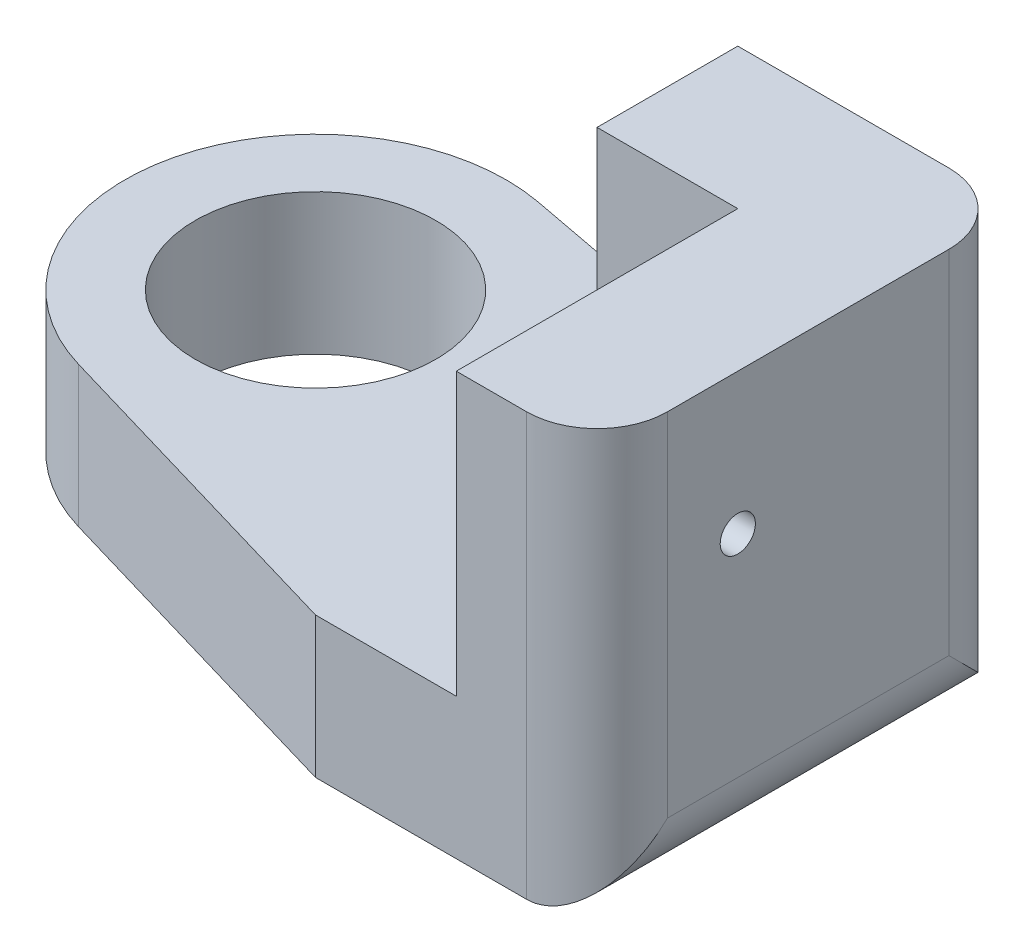
from build123d import *

# Parameters (mm, degrees)
SKETCH1_W           = 20
SKETCH1_H           = 30
BOSS_EXTRUDE1_DEPTH = 10
BOSS_EXTRUDE2_DEPTH = 10
SKETCH4_R           = 8.55
BOSS_EXTRUDE3_DEPTH = 10
FILLET1_R           = 5
BOSS_EXTRUDE4_DEPTH = 10
SKETCH6_R           = 1.25
CUT_EXTRUDE1_DEPTH  = 10


with BuildPart() as part:
    # Sketch1 → Boss-Extrude1 (new body)
    with BuildSketch(Plane(origin=(0, 0, 0), x_dir=(1, 0, 0), z_dir=(0, 1, 0))):
        with Locations((10, -15)):
            Rectangle(SKETCH1_W, SKETCH1_H)
    extrude(amount=BOSS_EXTRUDE1_DEPTH)

    # Sketch2 → Boss-Extrude2 (add)
    with BuildSketch(Plane(origin=(0, 10, 0), x_dir=(1, 0, 0), z_dir=(0, 1, 0))):
        Polygon((0, 0), (0, -10), (10, -10), (10, -30), (20, -30), (20, 0), align=None)
    extrude(amount=BOSS_EXTRUDE2_DEPTH)

    # Sketch4 → Boss-Extrude3 (add)
    with BuildSketch(Plane(origin=(0, 10, 0), x_dir=(1, 0, 0), z_dir=(0, 1, 0))):
        with BuildLine():
            Line((0, 0), (-17.51372228, 3.319944561))
            ThreePointArc((-17.51372228, 3.319944561), (-33.173842605, -6.829452566), (-23.846362973, -22.992612973))
            Line((-23.846362973, -22.992612973), (0, -30))
            Line((0, -30), (0, 0))
        make_face()
        with Locations(Location((-20, -10, 0), (0, 0, 270))):
            Circle(SKETCH4_R, mode=Mode.SUBTRACT)
    extrude(amount=-BOSS_EXTRUDE3_DEPTH)

    # Fillet1
    fillet1_edges = [part.edges().sort_by_distance(p)[0] for p in [
        (0, 10, 5),
        (20, 0, 15),
        (20, 10, 0),
        (20, 10, 30),
    ]]
    fillet(fillet1_edges, radius=FILLET1_R)

    # Sketch5 → Boss-Extrude4 (add)
    with BuildSketch(Plane(origin=(0, 20, 0), x_dir=(1, 0, 0), z_dir=(0, 1, 0))):
        with BuildLine():
            Line((10, -30), (15, -30))
            ThreePointArc((15, -30), (18.535533906, -28.535533906), (20, -25))
            Line((20, -25), (20, -5))
            ThreePointArc((20, -5), (18.535533906, -1.464466094), (15, 0))
            Line((15, 0), (0, 0))
            Line((0, 0), (0, -10))
            Line((0, -10), (10, -10))
            Line((10, -10), (10, -30))
        make_face()
    extrude(amount=BOSS_EXTRUDE4_DEPTH)

    # Sketch6 → Cut-Extrude1 (cut)
    with BuildSketch(Plane.ZY.offset(-10)):
        with Locations((20, 20)):
            Circle(SKETCH6_R)
    extrude(amount=-CUT_EXTRUDE1_DEPTH, mode=Mode.SUBTRACT)


solid = part.part
